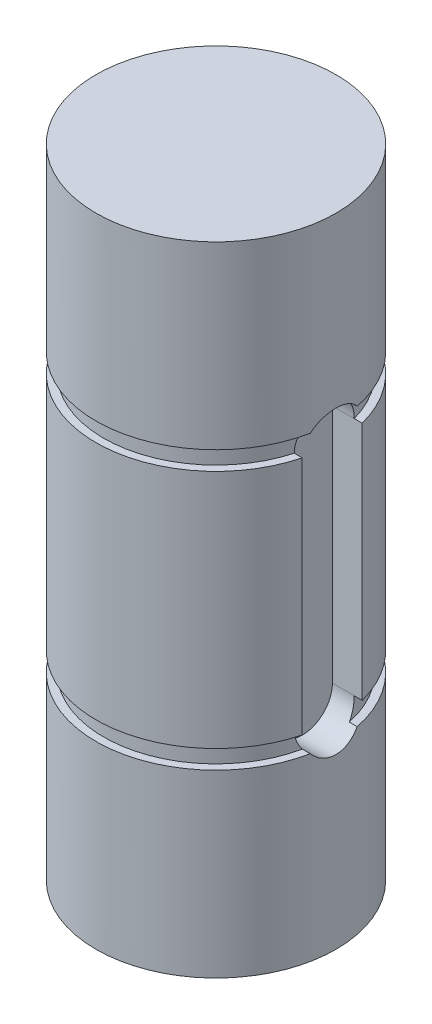
from build123d import *

# Parameters (mm, degrees)
SKETCH1_R           = 2.5
BOSS_EXTRUDE1_DEPTH = 13.28
SKETCH2_W           = 6.44702982
SKETCH2_H           = 0.39
SKETCH3_W           = 6.610697995
SKETCH3_H           = 0.39
CUT_EXTRUDE1_DEPTH  = 0.7


with BuildPart() as part:
    # Sketch1 → Boss-Extrude1 (new body)
    with BuildSketch(Plane(origin=(0, 0, 0), x_dir=(1, 0, 0), z_dir=(0, 1, 0))):
        with Locations(Location((0, 0, 0), (0, 0, 90))):
            Circle(SKETCH1_R)
    extrude(amount=BOSS_EXTRUDE1_DEPTH)

    # Sketch2 → Cut-Revolve1 (revolve, cut)
    with BuildSketch(Plane(origin=(0, 0, 0), x_dir=(0, 0, -1), z_dir=(1, 0, 0)), mode=Mode.PRIVATE) as cut_revolve1_sk:
        with Locations((-5.56351491, 9.335)):
            Rectangle(SKETCH2_W, SKETCH2_H)
    revolve(cut_revolve1_sk.sketch.rotate(Axis((0, 10.194505394, 0), (0, -1, 0)), 180), axis=Axis((0, 10.194505394, 0), (0, -1, 0)), mode=Mode.SUBTRACT)

    # Sketch3 → Cut-Revolve2 (revolve, cut)
    with BuildSketch(Plane(origin=(0, 0, 0), x_dir=(0, 0, -1), z_dir=(1, 0, 0)), mode=Mode.PRIVATE) as cut_revolve2_sk:
        with Locations((-5.645348998, 3.945)):
            Rectangle(SKETCH3_W, SKETCH3_H)
    revolve(cut_revolve2_sk.sketch.rotate(Axis((0, 6.07806317, 0), (0, -1, 0)), 180), axis=Axis((0, 6.07806317, 0), (0, -1, 0)), mode=Mode.SUBTRACT)

    # Sketch4 → Cut-Extrude1 (cut)
    with BuildSketch(Plane(origin=(2.5, 0, 0), x_dir=(0, 0, -1), z_dir=(1, 0, 0))):
        with BuildLine():
            Line((0.625, 9.14), (0.625, 4.14))
            ThreePointArc((0.625, 4.14), (0, 3.515), (-0.625, 4.14))
            Line((-0.625, 4.14), (-0.625, 9.14))
            ThreePointArc((-0.625, 9.14), (0, 9.765), (0.625, 9.14))
        make_face()
    extrude(amount=-CUT_EXTRUDE1_DEPTH, mode=Mode.SUBTRACT)


solid = part.part
